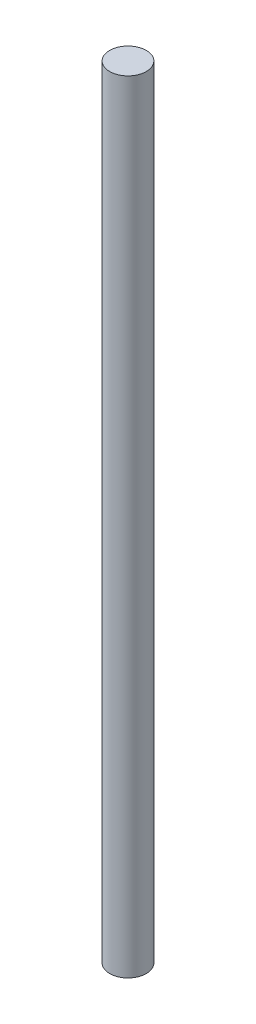
from build123d import *

# Parameters (mm, degrees)
SKETCH_1_R      = 1.5
EXTRUDE_1_DEPTH = 64


with BuildPart() as part:
    # 草图1 → 凸台-拉伸1 (new body)
    with BuildSketch(Plane(origin=(0, 0, 0), x_dir=(1, 0, 0), z_dir=(0, 1, 0))):
        with Locations(Location((0, 0, 0), (0, 0, 270))):
            Circle(SKETCH_1_R)
    extrude(amount=EXTRUDE_1_DEPTH)


solid = part.part
